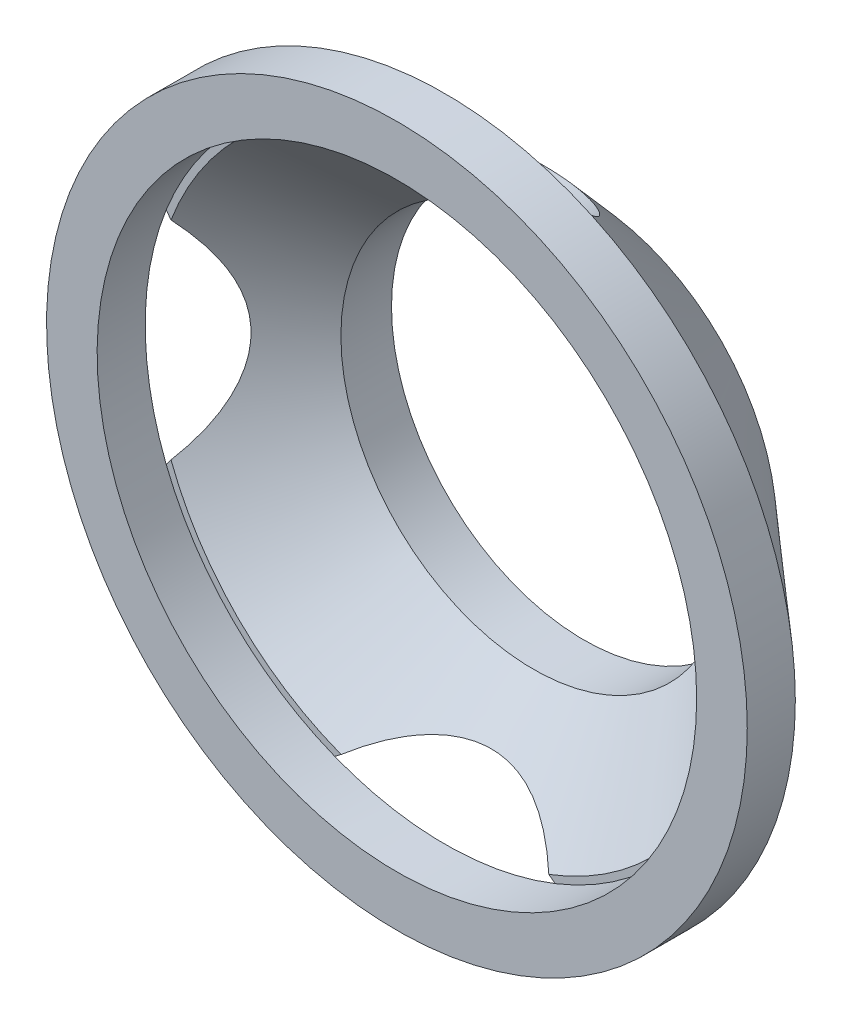
from build123d import *

# Parameters (mm, degrees)
SKETCH1_R           = 13.85
SKETCH1_R_2         = 11.85
BOSS_EXTRUDE1_DEPTH = 1.9
SKETCH4_R           = 7
SKETCH4_R_2         = 7.613586195
CUT_EXTRUDE2_DEPTH  = 5.5


with BuildPart() as part:
    # Sketch1 → Boss-Extrude1 (new body)
    with BuildSketch(Plane.XY):
        with Locations(Location((0, 0, 0), (0, 0, 180))):
            Circle(SKETCH1_R)
        with Locations(Location((0, 0, 0), (0, 0, 180))):
            Circle(SKETCH1_R_2, mode=Mode.SUBTRACT)
    extrude(amount=BOSS_EXTRUDE1_DEPTH)

    # Sketch2 → Revolve1 (revolve)
    with BuildSketch(Plane(origin=(0, 0, 0), x_dir=(1, 0, 0), z_dir=(0, 1, 0))):
        Polygon((-13.85, 0), (-7.613586195, 5.5), (0, 5.5), (0, 3.5), (-7.613586195, 3.5), (-11.582213162, 0), align=None)
    revolve(axis=Axis((0, 0, -5.5), (0, 0, 1)))

    # Sketch4 → Cut-Extrude2 (cut)
    with BuildSketch(Plane(origin=(0, 0, -5.5), x_dir=(-1, 0, 0), z_dir=(0, 0, -1))):
        with Locations((16.5, 0)):
            Circle(SKETCH4_R)
        Circle(SKETCH4_R_2)
        with Locations((0, -16.5)):
            Circle(SKETCH4_R)
        with Locations((0, 16.5)):
            Circle(SKETCH4_R)
    extrude(amount=-CUT_EXTRUDE2_DEPTH, mode=Mode.SUBTRACT)


solid = part.part
